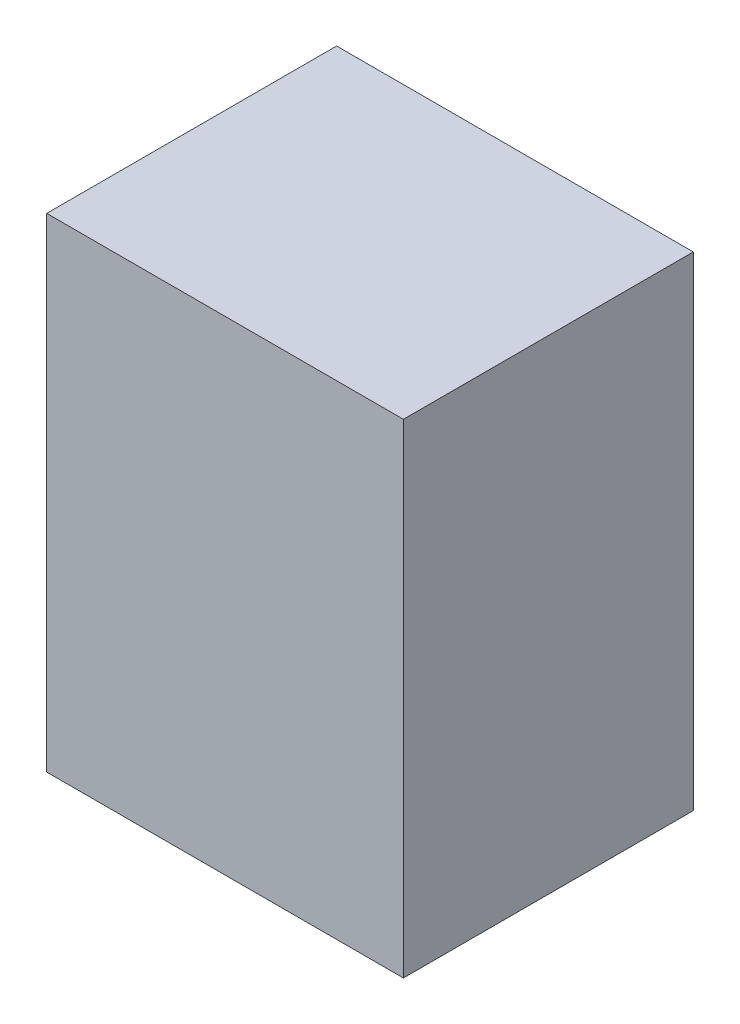
from build123d import *

# Parameters (mm, degrees)
SKETCH1_W                 = 8.92
SKETCH1_H                 = 12.101430126
BOSS_EXTRUDE1_DEPTH       = 7.25
SHELL1_T                  = -0.5
SHELL1_THICKNESS_2_FACE_W = 7.92
SHELL1_THICKNESS_2_FACE_H = 11.101430126
SHELL1_THICKNESS_2_DEPTH  = 0.3


with BuildPart() as part:
    # Sketch1 → Boss-Extrude1 (new body)
    with BuildSketch(Plane.XY):
        with Locations((-49.2755, 71.520715063)):
            Rectangle(SKETCH1_W, SKETCH1_H)
    extrude(amount=BOSS_EXTRUDE1_DEPTH)

    # Shell1
    shell1_openings = [part.faces().sort_by_distance(p)[0] for p in [
        (-49.2755, 71.520715063, 0),
    ]]
    offset(amount=SHELL1_T, openings=shell1_openings, kind=Kind.INTERSECTION)

    # Shell1 thickness 2 face (on inner face of the shell) → Shell1 thickness 2 (cut)
    with BuildSketch(Plane(origin=(-49.2755, 71.520715063, 6.75), x_dir=(1, 0, 0), z_dir=(0, 0, 1))):
        Rectangle(SHELL1_THICKNESS_2_FACE_W, SHELL1_THICKNESS_2_FACE_H)
    extrude(amount=SHELL1_THICKNESS_2_DEPTH, mode=Mode.SUBTRACT)


solid = part.part
